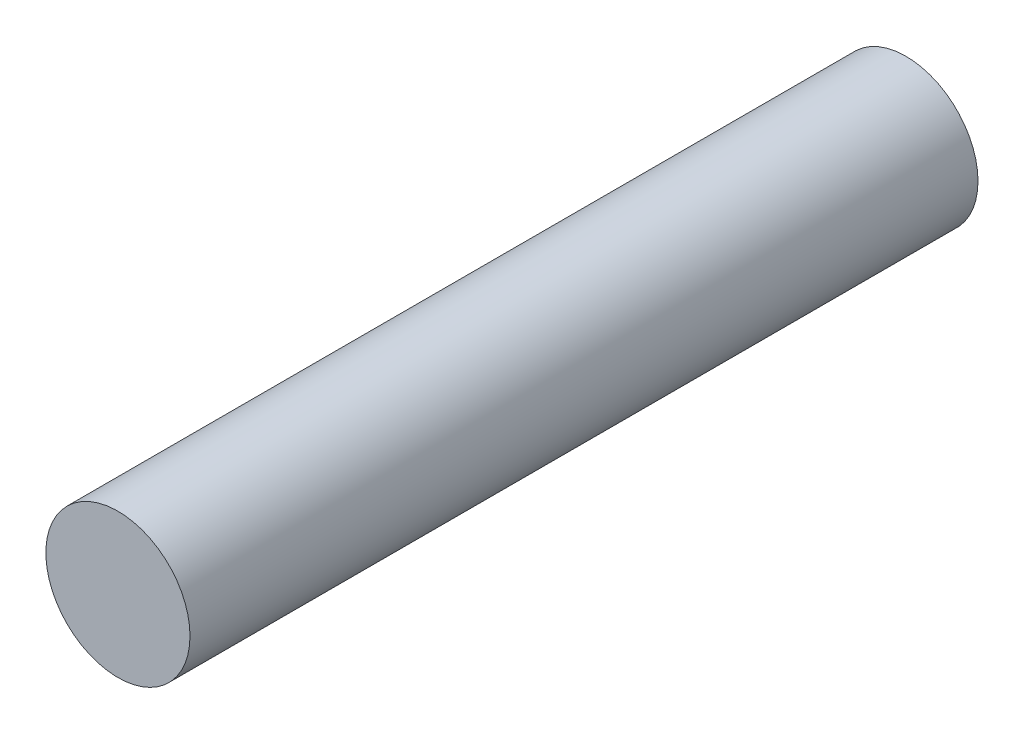
from build123d import *

# Parameters (mm, degrees)
CROQUIS1_R              = 7.5
SALIENTE_EXTRUIR1_DEPTH = 82


with BuildPart() as part:
    # Croquis1 → Saliente-Extruir1 (new body)
    with BuildSketch(Plane.XY):
        Circle(CROQUIS1_R)
    extrude(amount=SALIENTE_EXTRUIR1_DEPTH)


solid = part.part
